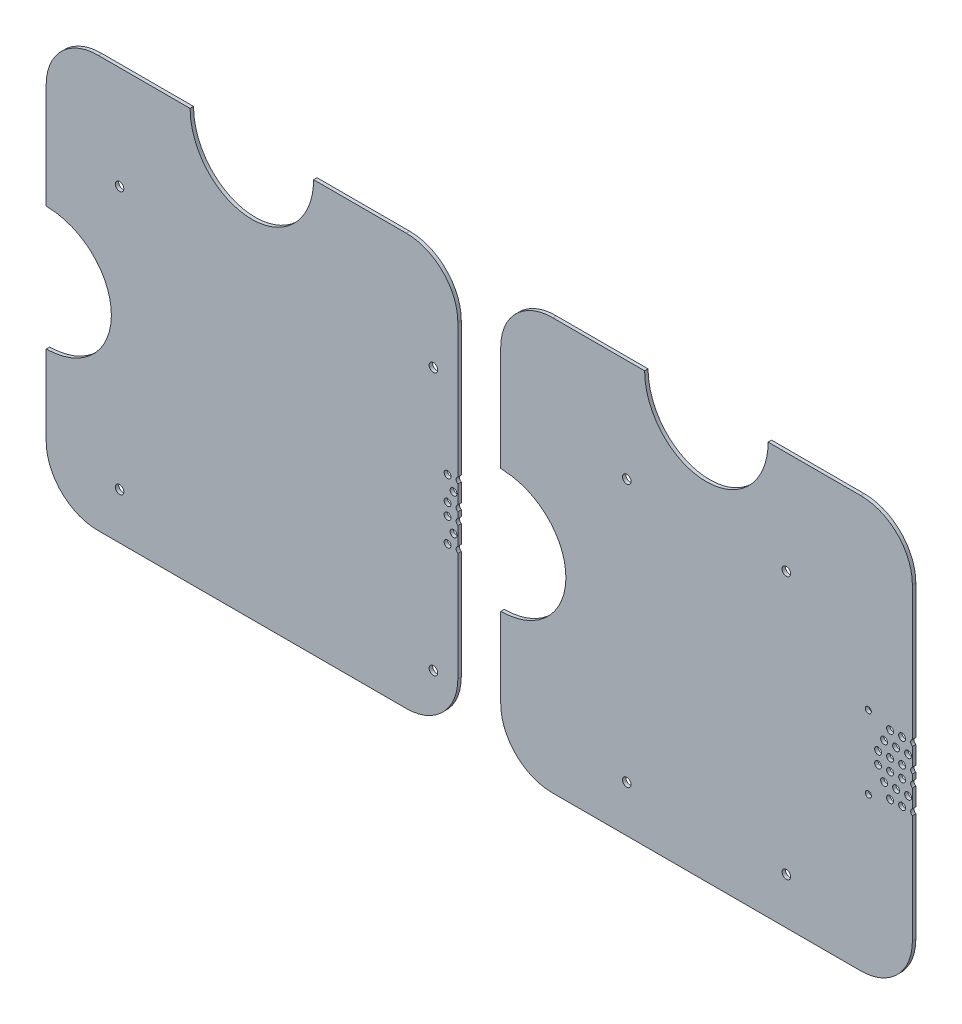
from build123d import *

# Parameters (mm, degrees)
SKETCH1_R             = 3.175
SKETCH1_R_2           = 2.54
BOSS_EXTRUDE1_DEPTH   = 2.54
SKETCH1_R_3           = 2.2479
BOSS_EXTRUDE1_2_DEPTH = 2.54


with BuildPart() as part:
    # Sketch1 → Boss-Extrude1 (new body)
    with BuildSketch(Plane.XY):
        with BuildLine():
            Line((436.546494745, -68.248241138), (436.546494745, 30.968825026))
            ThreePointArc((436.546494745, 30.968825026), (425.387263108, 57.90959339), (398.446494745, 69.068825026))
            Line((398.446494745, 69.068825026), (329.729754398, 69.068825026))
            add(Edge.make_bspline(
                [(238.289754398, 69.068825026), (238.289754398, 20.808825026), (284.009754398, 20.808825026), (329.729754398, 20.808825026), (329.729754398, 69.068825026)],
                knots=[1.570796327, 1.570796327, 1.570796327, 3.141592654, 3.141592654, 4.71238898, 4.71238898, 4.71238898], degree=2, weights=[1, 0.707106781, 1, 0.707106781, 1]))
            Line((238.289754398, 69.068825026), (170.413558712, 69.064604825))
            ThreePointArc((170.413558712, 69.064604825), (143.106965366, 58.109340286), (131.746494745, 30.968825026))
            Line((131.746494745, 30.968825026), (131.746494745, -46.865020315))
            add(Edge.make_bspline(
                [(131.746494745, -46.865020315), (132.580020786, -46.914016889), (133.622633301, -46.976252059), (134.871653426, -47.047965905), (135.643950912, -47.099617088), (137.02288068, -47.216537841), (138.97366436, -47.450696512), (142.083370752, -47.970650492), (145.908781969, -48.888990347), (151.84340007, -50.916657488), (158.811428431, -54.473363662), (166.153007291, -60.192670592), (172.160328075, -67.159948003), (178.130496756, -77.747382085), (181.257160071, -92.672945664), (178.130496756, -107.598509243), (172.160328075, -118.185943324), (166.153007291, -125.153220735), (158.811428431, -130.872527665), (151.84340007, -134.429233839), (145.908781969, -136.45690098), (142.083370752, -137.375240836), (138.97366436, -137.895194815), (137.02288068, -138.129353486), (135.643950912, -138.246274239), (134.871653426, -138.297925422), (133.622633301, -138.369639268), (132.580020786, -138.431874438), (131.746494745, -138.480871013)],
                knots=[1.574223693, 1.574223693, 1.574223693, 1.574223693, 1.623203973, 1.635449043, 1.647694113, 1.672184253, 1.721164533, 1.770144813, 1.868105373, 1.966065933, 2.161987053, 2.357908173, 2.553829293, 2.749750413, 3.141592654, 3.533434894, 3.729356014, 3.925277134, 4.121198254, 4.317119374, 4.415079934, 4.513040494, 4.562020775, 4.611001055, 4.635491195, 4.647736265, 4.659981335, 4.708961615, 4.708961615, 4.708961615, 4.708961615], degree=3))
            Line((131.746494745, -138.480871013), (131.746494745, -197.631174974))
            ThreePointArc((131.746494745, -197.631174974), (142.905726382, -224.571943337), (169.846494745, -235.731174974))
            Line((169.846494745, -235.731174974), (398.446494745, -235.731174974))
            ThreePointArc((398.446494745, -235.731174974), (425.387263108, -224.571943337), (436.546494745, -197.631174974))
            Line((436.546494745, -197.631174974), (436.546494745, -117.097650189))
            ThreePointArc((436.546494745, -117.097650189), (435.276494745, -114.897945664), (436.546494745, -112.698241138))
            Line((436.546494745, -112.698241138), (436.546494745, -99.317650189))
            ThreePointArc((436.546494745, -99.317650189), (435.276494745, -97.117945664), (436.546494745, -94.918241138))
            Line((436.546494745, -94.918241138), (436.546494745, -90.427650189))
            ThreePointArc((436.546494745, -90.427650189), (435.276494745, -88.227945664), (436.546494745, -86.028241138))
            Line((436.546494745, -86.028241138), (436.546494745, -72.647650189))
            ThreePointArc((436.546494745, -72.647650189), (435.276494745, -70.447945664), (436.546494745, -68.248241138))
        make_face()
        with Locations((186.051694745, -201.364974974)):
            Circle(SKETCH1_R, mode=Mode.SUBTRACT)
        with Locations((418.461694745, -201.364974974)):
            Circle(SKETCH1_R, mode=Mode.SUBTRACT)
        with Locations((428.926494745, -114.897945664)):
            Circle(SKETCH1_R_2, mode=Mode.SUBTRACT)
        with Locations((433.371494745, -106.007945664)):
            Circle(SKETCH1_R_2, mode=Mode.SUBTRACT)
        with Locations((428.926494745, -97.117945664)):
            Circle(SKETCH1_R_2, mode=Mode.SUBTRACT)
        with Locations((428.926494745, -88.227945664)):
            Circle(SKETCH1_R_2, mode=Mode.SUBTRACT)
        with Locations((433.371494745, -79.337945664)):
            Circle(SKETCH1_R_2, mode=Mode.SUBTRACT)
        with Locations((428.926494745, -70.447945664)):
            Circle(SKETCH1_R_2, mode=Mode.SUBTRACT)
        with Locations((186.051694745, -7.054974974)):
            Circle(SKETCH1_R, mode=Mode.SUBTRACT)
        with Locations((418.461694745, -7.054974974)):
            Circle(SKETCH1_R, mode=Mode.SUBTRACT)
    extrude(amount=BOSS_EXTRUDE1_DEPTH)


with BuildPart() as body_2:
    # Sketch1 → Boss-Extrude1 2 (new body)
    with BuildSketch(Plane.XY):
        with BuildLine():
            Line((773.092951703, -68.248241138), (773.092951703, 30.968825026))
            ThreePointArc((773.092951703, 30.968825026), (761.933720067, 57.90959339), (734.992951703, 69.068825026))
            Line((734.992951703, 69.068825026), (666.276211341, 69.067553287))
            add(Edge.make_bspline(
                [(574.836211443, 69.065861008), (574.839019287, 20.808825026), (620.556211357, 20.808825026), (666.275006567, 20.808825026), (666.276211341, 69.067553287)],
                knots=[4.712457197, 4.712457197, 4.712457197, 6.283185307, 6.283185307, 7.853952365, 7.853952365, 7.853952365], degree=2, weights=[0.999974561, 0.707119501, 1, 0.707112239, 0.999989085]))
            Line((574.836211443, 69.065861008), (506.960015671, 69.064604825))
            ThreePointArc((506.960015671, 69.064604825), (479.653422324, 58.109340286), (468.292951703, 30.968825026))
            Line((468.292951703, 30.968825026), (468.292951703, -46.865020315))
            add(Edge.make_bspline(
                [(468.292951703, -46.865020315), (469.126477744, -46.914016889), (470.16909026, -46.976252059), (471.418110384, -47.047965905), (472.19040787, -47.099617088), (473.569337638, -47.216537841), (475.520121319, -47.450696512), (478.629827711, -47.970650492), (482.455238927, -48.888990347), (488.389857028, -50.916657488), (495.357885389, -54.473363662), (502.699464249, -60.192670592), (508.706785033, -67.159948003), (514.676953714, -77.747382085), (517.803617029, -92.672945664), (514.676953714, -107.598509243), (508.706785033, -118.185943324), (502.699464249, -125.153220735), (495.357885389, -130.872527665), (488.389857028, -134.429233839), (482.455238927, -136.45690098), (478.629827711, -137.375240836), (475.520121319, -137.895194815), (473.569337638, -138.129353486), (472.19040787, -138.246274239), (471.418110384, -138.297925422), (470.16909026, -138.369639268), (469.126477744, -138.431874438), (468.292951703, -138.480871013)],
                knots=[1.574223693, 1.574223693, 1.574223693, 1.574223693, 1.623203973, 1.635449043, 1.647694113, 1.672184253, 1.721164533, 1.770144813, 1.868105373, 1.966065933, 2.161987053, 2.357908173, 2.553829293, 2.749750413, 3.141592654, 3.533434894, 3.729356014, 3.925277134, 4.121198254, 4.317119374, 4.415079934, 4.513040494, 4.562020775, 4.611001055, 4.635491195, 4.647736265, 4.659981335, 4.708961615, 4.708961615, 4.708961615, 4.708961615], degree=3))
            Line((468.292951703, -138.480871013), (468.292951703, -197.631174974))
            ThreePointArc((468.292951703, -197.631174974), (479.45218334, -224.571943337), (506.392951703, -235.731174974))
            Line((506.392951703, -235.731174974), (734.992951703, -235.731174974))
            ThreePointArc((734.992951703, -235.731174974), (761.933720067, -224.571943337), (773.092951703, -197.631174974))
            Line((773.092951703, -197.631174974), (773.092951703, -117.097650189))
            ThreePointArc((773.092951703, -117.097650189), (771.822951703, -114.897945664), (773.092951703, -112.698241138))
            Line((773.092951703, -112.698241138), (773.092951703, -99.317650189))
            ThreePointArc((773.092951703, -99.317650189), (771.822951703, -97.117945664), (773.092951703, -94.918241138))
            Line((773.092951703, -94.918241138), (773.092951703, -90.427650189))
            ThreePointArc((773.092951703, -90.427650189), (771.822951703, -88.227945664), (773.092951703, -86.028241138))
            Line((773.092951703, -86.028241138), (773.092951703, -72.647650189))
            ThreePointArc((773.092951703, -72.647650189), (771.822951703, -70.447945664), (773.092951703, -68.248241138))
        make_face()
        with Locations((561.637951703, -201.364974974)):
            Circle(SKETCH1_R, mode=Mode.SUBTRACT)
        with Locations((679.747951703, -201.364974974)):
            Circle(SKETCH1_R, mode=Mode.SUBTRACT)
        with Locations((740.475162403, -119.701149329)):
            Circle(SKETCH1_R_3, mode=Mode.SUBTRACT)
        with Locations((756.582951703, -114.897945664)):
            Circle(SKETCH1_R_2, mode=Mode.SUBTRACT)
        with Locations((765.472951703, -114.897945664)):
            Circle(SKETCH1_R_2, mode=Mode.SUBTRACT)
        with Locations((752.137951703, -106.007945664)):
            Circle(SKETCH1_R_2, mode=Mode.SUBTRACT)
        with Locations((761.027951703, -106.007945664)):
            Circle(SKETCH1_R_2, mode=Mode.SUBTRACT)
        with Locations((769.917951703, -106.007945664)):
            Circle(SKETCH1_R_2, mode=Mode.SUBTRACT)
        with Locations((747.692951703, -97.117945664)):
            Circle(SKETCH1_R_2, mode=Mode.SUBTRACT)
        with Locations((756.582951703, -97.117945664)):
            Circle(SKETCH1_R_2, mode=Mode.SUBTRACT)
        with Locations((765.472951703, -97.117945664)):
            Circle(SKETCH1_R_2, mode=Mode.SUBTRACT)
        with Locations((747.692951703, -88.227945664)):
            Circle(SKETCH1_R_2, mode=Mode.SUBTRACT)
        with Locations((756.582951703, -88.227945664)):
            Circle(SKETCH1_R_2, mode=Mode.SUBTRACT)
        with Locations((765.472951703, -88.227945664)):
            Circle(SKETCH1_R_2, mode=Mode.SUBTRACT)
        with Locations((752.137951703, -79.337945664)):
            Circle(SKETCH1_R_2, mode=Mode.SUBTRACT)
        with Locations((761.027951703, -79.337945664)):
            Circle(SKETCH1_R_2, mode=Mode.SUBTRACT)
        with Locations((769.917951703, -79.337945664)):
            Circle(SKETCH1_R_2, mode=Mode.SUBTRACT)
        with Locations((740.475162403, -65.644741999)):
            Circle(SKETCH1_R_3, mode=Mode.SUBTRACT)
        with Locations((756.582951703, -70.447945664)):
            Circle(SKETCH1_R_2, mode=Mode.SUBTRACT)
        with Locations((765.472951703, -70.447945664)):
            Circle(SKETCH1_R_2, mode=Mode.SUBTRACT)
        with Locations((561.637951703, -7.054974974)):
            Circle(SKETCH1_R, mode=Mode.SUBTRACT)
        with Locations((679.747951703, -7.054974974)):
            Circle(SKETCH1_R, mode=Mode.SUBTRACT)
    extrude(amount=BOSS_EXTRUDE1_2_DEPTH)


solid = Compound([part.part, body_2.part])
